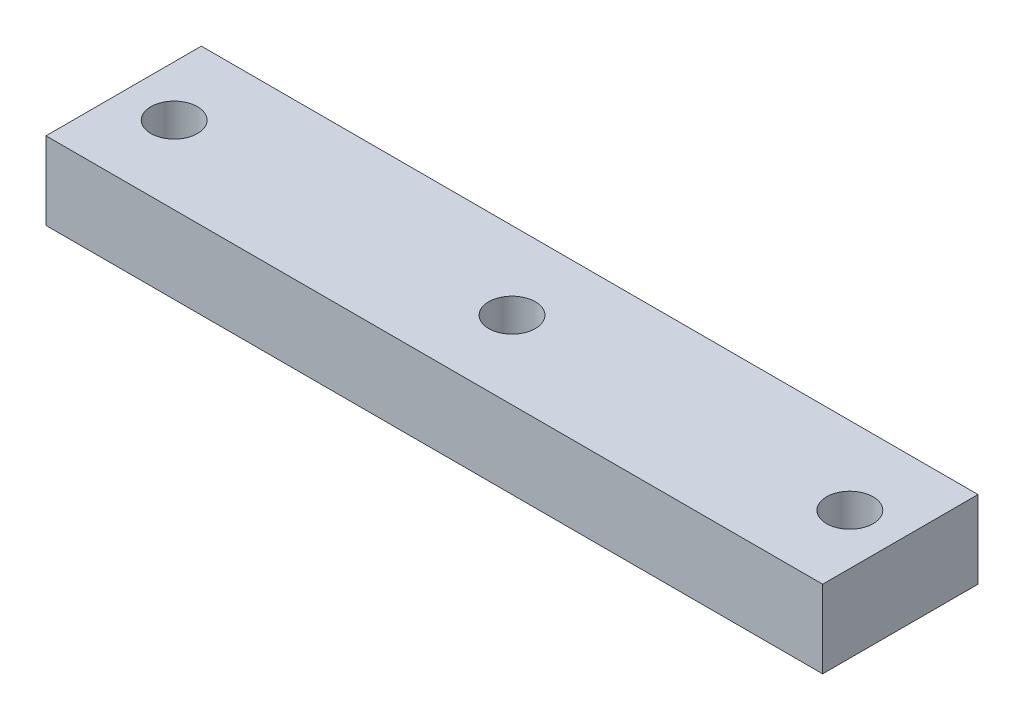
from build123d import *

# Parameters (mm, degrees)
SKETCH3_W           = 50
SKETCH3_H           = 10
SKETCH3_R           = 1.5
BOSS_EXTRUDE2_DEPTH = 5


with BuildPart() as part:
    # Sketch3 → Boss-Extrude2 (new body)
    with BuildSketch(Plane(origin=(0, 0, 0), x_dir=(1, 0, 0), z_dir=(0, 1, 0))):
        with Locations((-26.234597884, -5)):
            Rectangle(SKETCH3_W, SKETCH3_H)
        with Locations(Location((-4.484597884, -5, 0), (0, 0, 270))):
            Circle(SKETCH3_R, mode=Mode.SUBTRACT)
        with Locations(Location((-26.234597884, -5, 0), (0, 0, 270))):
            Circle(SKETCH3_R, mode=Mode.SUBTRACT)
        with Locations(Location((-47.984597884, -5, 0), (0, 0, 270))):
            Circle(SKETCH3_R, mode=Mode.SUBTRACT)
    extrude(amount=BOSS_EXTRUDE2_DEPTH)


solid = part.part
